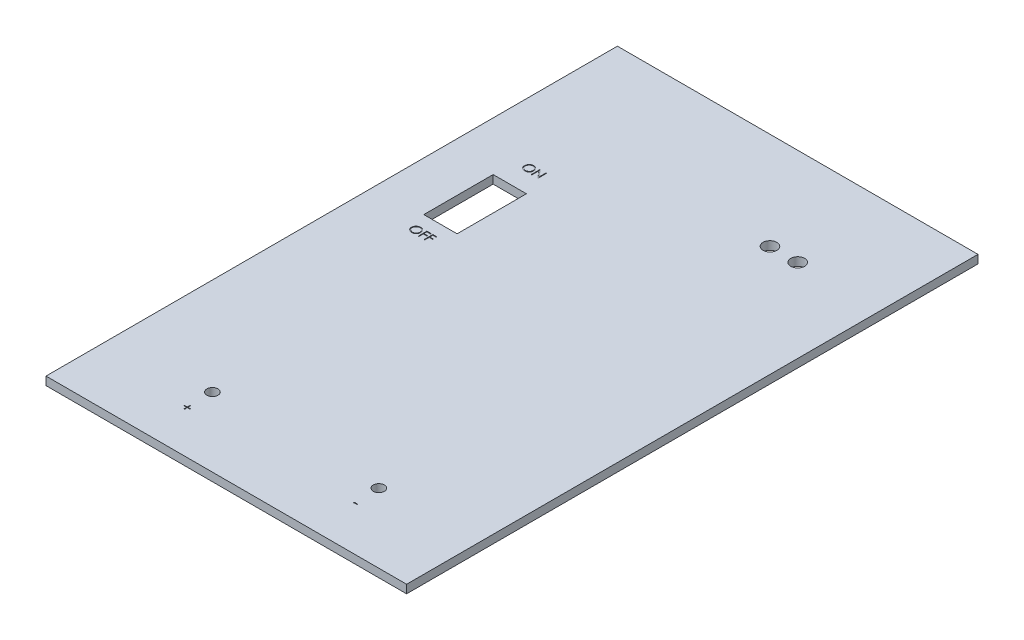
from build123d import *

# Parameters (mm, degrees)
SKETCH1_W           = 130
SKETCH1_H           = 206
BOSS_EXTRUDE1_DEPTH = 3
SKETCH2_R           = 2.5
CUT_EXTRUDE1_DEPTH  = 10
SKETCH4_R           = 2
SKETCH4_W           = 12
SKETCH4_H           = 25
CUT_EXTRUDE2_DEPTH  = 4
CUT_EXTRUDE3_DEPTH  = 0.2
CUT_EXTRUDE4_DEPTH  = 0.2
CUT_EXTRUDE5_DEPTH  = 0.2
SKETCH9_W           = 1.221153846
SKETCH9_H           = 0.325641026
CUT_EXTRUDE6_DEPTH  = 0.2


with BuildPart() as part:
    # Sketch1 → Boss-Extrude1 (new body)
    with BuildSketch(Plane(origin=(0, 0, 0), x_dir=(1, 0, 0), z_dir=(0, 1, 0))):
        Rectangle(SKETCH1_W, SKETCH1_H)
    extrude(amount=BOSS_EXTRUDE1_DEPTH)

    # Sketch2 → Cut-Extrude1 (cut)
    with BuildSketch(Plane(origin=(0, 3, 0), x_dir=(1, 0, 0), z_dir=(0, 1, 0))):
        with Locations(Location((35, 68, 0), (0, 0, 270))):
            Circle(SKETCH2_R)
        with Locations(Location((25, 68, 0), (0, 0, 270))):
            Circle(SKETCH2_R)
    extrude(amount=-CUT_EXTRUDE1_DEPTH, mode=Mode.SUBTRACT)

    # Sketch4 → Cut-Extrude2 (cut)
    with BuildSketch(Plane(origin=(0, 3, 0), x_dir=(1, 0, 0), z_dir=(0, 1, 0))):
        with Locations(Location((-30, -78, 0), (0, 0, 270))):
            Circle(SKETCH4_R)
        with Locations(Location((30, -78, 0), (0, 0, 270))):
            Circle(SKETCH4_R)
        with Locations((-41.313427864, 28.013893321)):
            Rectangle(SKETCH4_W, SKETCH4_H)
    extrude(amount=-CUT_EXTRUDE2_DEPTH, mode=Mode.SUBTRACT)

    # Sketch6 → Cut-Extrude3 (cut)
    # profile 1 of 3: a face of its own
    with BuildSketch(Plane(origin=(0, 3, 0), x_dir=(1, 0, 0), z_dir=(0, 1, 0))):
        with BuildLine():
            add(Edge.make_bspline(
                [(-43.926968434, 11.005869869), (-43.868178224, 11.004380812), (-43.7527094, 11.001456183), (-43.583005743, 10.97906871), (-43.420994478, 10.940337892), (-43.265355852, 10.888755044), (-43.117951509, 10.81994428), (-42.977671942, 10.736772753), (-42.844850921, 10.638369108), (-42.721278668, 10.525494024), (-42.608197005, 10.40268189), (-42.508569237, 10.271619786), (-42.425073728, 10.133100158), (-42.356506621, 9.987539262), (-42.302714311, 9.835266291), (-42.265594893, 9.675469446), (-42.241883856, 9.509184091), (-42.23911183, 9.395766864), (-42.237705613, 9.338231647)],
                knots=[0, 0, 0, 0, 1.065120563, 2.091984664, 3.0946048, 4.079830382, 5.057816894, 6.036188127, 7.030412546, 8.04752943, 9.064399622, 10.05169764, 11.02544977, 11.989514704, 12.962713494, 13.945757189, 14.957906945, 16, 16, 16, 16], degree=3))
            add(Edge.make_bspline(
                [(-42.237705613, 9.338231647), (-42.239111624, 9.28112025), (-42.241883033, 9.168547068), (-42.265621852, 9.003316944), (-42.302851902, 8.844484669), (-42.356007087, 8.692315399), (-42.424247342, 8.546648609), (-42.508298819, 8.407867586), (-42.607305488, 8.275926834), (-42.719978846, 8.152271773), (-42.842806934, 8.038881211), (-42.974551533, 7.940076231), (-43.112249759, 7.85505506), (-43.257673566, 7.787215585), (-43.408894314, 7.732993914), (-43.567265421, 7.696025457), (-43.732044795, 7.672179353), (-43.844413491, 7.669441128), (-43.901527729, 7.668049356)],
                knots=[0, 0, 0, 0, 1.043624062, 2.057103931, 3.04512605, 4.022047818, 4.998200453, 5.980619268, 6.982898556, 8.009068085, 9.034988726, 10.034168286, 11.015286542, 11.987931943, 12.962482838, 13.94673481, 14.956375938, 16, 16, 16, 16], degree=3))
            add(Edge.make_bspline(
                [(-43.901527729, 7.668049356), (-43.959062647, 7.669454871), (-44.072479285, 7.672225516), (-44.238973596, 7.69597579), (-44.398882692, 7.733115401), (-44.551749282, 7.786191818), (-44.697658611, 7.854787449), (-44.836896044, 7.938429993), (-44.968902699, 8.0376779), (-45.09258414, 8.150314721), (-45.205749484, 8.272934629), (-45.304409775, 8.404319989), (-45.388071128, 8.541893153), (-45.456436436, 8.686035907), (-45.510560625, 8.83605143), (-45.54748571, 8.992940406), (-45.57137618, 9.155808386), (-45.57412922, 9.266700158), (-45.575526126, 9.322967224)],
                knots=[0, 0, 0, 0, 1.053102029, 2.075944431, 3.073151272, 4.055350789, 5.033113405, 6.020478099, 7.024410459, 8.052272461, 9.079885166, 10.07527673, 11.055994387, 12.023226415, 12.992069828, 13.970394897, 14.97016774, 16, 16, 16, 16], degree=3))
            add(Edge.make_bspline(
                [(-45.575526126, 9.322967224), (-45.575041135, 9.360734003), (-45.574077272, 9.435791115), (-45.56247338, 9.547248674), (-45.545635265, 9.65691377), (-45.52150353, 9.764474559), (-45.489942518, 9.869667738), (-45.452702465, 9.973218787), (-45.407218462, 10.074078308), (-45.355801017, 10.172724099), (-45.29841352, 10.267618413), (-45.235026233, 10.357316321), (-45.167865577, 10.442570511), (-45.094238784, 10.521171722), (-45.016572438, 10.595406538), (-44.933606623, 10.664134146), (-44.845847587, 10.72797428), (-44.752917714, 10.785505589), (-44.65710685, 10.837538519), (-44.558340059, 10.882189769), (-44.457958741, 10.920512982), (-44.355492739, 10.951574302), (-44.251214153, 10.976096221), (-44.144895391, 10.99279432), (-44.036621154, 11.004427808), (-43.9636766, 11.005387114), (-43.926968434, 11.005869869)],
                knots=[0, 0, 0, 0, 1.037015668, 2.060948919, 3.074880161, 4.083647147, 5.086022904, 6.090072063, 7.104153813, 8.122640571, 9.144368836, 10.147691507, 11.138137339, 12.123020368, 13.103399296, 14.087645067, 15.080126199, 16.082011238, 17.087798457, 18.072939717, 19.057185487, 20.037253025, 21.01195951, 21.997135196, 22.992090687, 24, 24, 24, 24], degree=3))
        make_face()
        with BuildLine():
            add(Edge.make_bspline(
                [(-43.912976046, 10.680228843), (-43.943106464, 10.67986155), (-44.00307925, 10.679130474), (-44.092237365, 10.669500504), (-44.180222905, 10.655775533), (-44.267054041, 10.636198011), (-44.35236746, 10.609524334), (-44.436958388, 10.578825796), (-44.520055444, 10.541432378), (-44.6013843, 10.499184282), (-44.68022869, 10.452422047), (-44.754625926, 10.400740515), (-44.824768611, 10.345351684), (-44.890485002, 10.286126289), (-44.951582137, 10.222762721), (-45.009262545, 10.156221583), (-45.061214237, 10.084600939), (-45.108826153, 10.009842927), (-45.151432694, 9.932044921), (-45.189319837, 9.852025975), (-45.220311474, 9.769133359), (-45.245586629, 9.684266373), (-45.266541458, 9.597559427), (-45.279816517, 9.508354764), (-45.289552301, 9.417100627), (-45.290241589, 9.355431374), (-45.290590229, 9.32423926)],
                knots=[0, 0, 0, 0, 1.008559885, 2.007477868, 2.99961109, 3.989939068, 4.984837346, 5.991145699, 7.001802488, 8.033829008, 9.059044045, 10.069351652, 11.065060232, 12.050310815, 13.029377138, 14.011219647, 14.996725999, 15.989392538, 16.977580475, 17.965360261, 18.951710183, 19.937753436, 20.929683414, 21.935841486, 22.955955122, 24, 24, 24, 24], degree=3))
            add(Edge.make_bspline(
                [(-45.290590229, 9.32423926), (-45.289433747, 9.278372102), (-45.287158589, 9.188137214), (-45.267239936, 9.055904684), (-45.236558574, 8.928824595), (-45.19133082, 8.807592292), (-45.134769905, 8.691165692), (-45.064895512, 8.580577626), (-44.982110484, 8.475798204), (-44.888072857, 8.377558924), (-44.785272973, 8.287891659), (-44.676113996, 8.209184853), (-44.561765367, 8.142591269), (-44.44192889, 8.088339525), (-44.317244337, 8.045350263), (-44.186908272, 8.015887504), (-44.051788927, 7.996496913), (-43.959686118, 7.99463477), (-43.912976046, 7.993690381)],
                knots=[0, 0, 0, 0, 1.032063989, 2.030389145, 3.003944642, 3.970395727, 4.937377036, 5.913328081, 6.909231446, 7.93887556, 8.970685674, 9.976071282, 10.964166581, 11.944589148, 12.933237628, 13.927779006, 14.949070134, 16, 16, 16, 16], degree=3))
            add(Edge.make_bspline(
                [(-43.912976046, 7.993690381), (-43.881580284, 7.994121732), (-43.819313058, 7.994977229), (-43.726697834, 8.003593886), (-43.635751128, 8.017411368), (-43.546600503, 8.037305605), (-43.459347138, 8.062204142), (-43.373626852, 8.09178401), (-43.290352689, 8.128687673), (-43.208474122, 8.169461887), (-43.130100388, 8.215944029), (-43.055283298, 8.265871494), (-42.985908659, 8.321178743), (-42.92024143, 8.379524187), (-42.858893455, 8.442084249), (-42.802279591, 8.508777593), (-42.750590471, 8.580025189), (-42.702996635, 8.654669807), (-42.660539389, 8.732680694), (-42.623546921, 8.812989759), (-42.592163301, 8.895399251), (-42.566828158, 8.980028033), (-42.546974917, 9.066715375), (-42.533295276, 9.155577346), (-42.523726335, 9.246436178), (-42.523005086, 9.307889533), (-42.522641511, 9.338867665)],
                knots=[0, 0, 0, 0, 1.047197238, 2.076906641, 3.100256066, 4.114471768, 5.12198147, 6.126382909, 7.136867548, 8.15857795, 9.17633901, 10.174870724, 11.156907918, 12.133735059, 13.104061851, 14.077631395, 15.04955518, 16.038496417, 17.029181396, 18.010275684, 18.986308667, 19.968651475, 20.955262928, 21.950658345, 22.966943676, 24, 24, 24, 24], degree=3))
            add(Edge.make_bspline(
                [(-42.522641511, 9.338867665), (-42.523005378, 9.369633873), (-42.523727174, 9.430664312), (-42.533290705, 9.520889483), (-42.54698937, 9.609112039), (-42.566731255, 9.694985632), (-42.592176752, 9.778532151), (-42.623552401, 9.85967313), (-42.660550494, 9.938710849), (-42.703012241, 10.015449962), (-42.750742309, 10.089087045), (-42.802897801, 10.15948352), (-42.860379224, 10.225317364), (-42.921544261, 10.288213836), (-42.987920707, 10.346831493), (-43.059207888, 10.40118978), (-43.134540367, 10.452600536), (-43.214302931, 10.498978724), (-43.29662066, 10.541808778), (-43.381088322, 10.578503616), (-43.466749005, 10.609684039), (-43.553384879, 10.636278714), (-43.641725152, 10.655698856), (-43.731172911, 10.669512873), (-43.821604403, 10.679127123), (-43.882422181, 10.679860438), (-43.912976046, 10.680228843)],
                knots=[0, 0, 0, 0, 1.02996197, 2.043119294, 3.035359645, 4.018872909, 4.991431989, 5.957985074, 6.929999688, 7.912076566, 8.892894881, 9.867085534, 10.843653904, 11.817741046, 12.803660682, 13.806313499, 14.818574707, 15.856120519, 16.894564902, 17.924820532, 18.937903209, 19.946497019, 20.957711757, 21.963978472, 22.977135795, 24, 24, 24, 24], degree=3))
        make_face(mode=Mode.SUBTRACT)
    # profile 2 of 3: a face of its own
    with BuildSketch(Plane(origin=(0, 3, 0), x_dir=(1, 0, 0), z_dir=(0, 1, 0))):
        Polygon((-41.586423562, 10.924459612), (-40.03962869, 10.924459612), (-40.03962869, 10.598818587), (-41.301487665, 10.598818587), (-41.301487665, 9.62189551), (-40.03962869, 9.62189551), (-40.03962869, 9.296254484), (-41.301487665, 9.296254484), (-41.301487665, 7.749459612), (-41.586423562, 7.749459612), align=None)
    # profile 3 of 3: a face of its own
    with BuildSketch(Plane(origin=(0, 3, 0), x_dir=(1, 0, 0), z_dir=(0, 1, 0))):
        Polygon((-39.469756895, 10.924459612), (-37.922962024, 10.924459612), (-37.922962024, 10.598818587), (-39.184820998, 10.598818587), (-39.184820998, 9.62189551), (-37.922962024, 9.62189551), (-37.922962024, 9.296254484), (-39.184820998, 9.296254484), (-39.184820998, 7.749459612), (-39.469756895, 7.749459612), align=None)
    extrude(amount=-CUT_EXTRUDE3_DEPTH, mode=Mode.SUBTRACT)

    # Sketch7 → Cut-Extrude4 (cut)
    # profile 1 of 2: a face of its own
    with BuildSketch(Plane(origin=(0, 3, 0), x_dir=(1, 0, 0), z_dir=(0, 1, 0))):
        with BuildLine():
            add(Edge.make_bspline(
                [(-42.796304845, 50.634513267), (-42.737514635, 50.633024211), (-42.622045811, 50.630099581), (-42.452342154, 50.607712109), (-42.290330889, 50.568981291), (-42.134692263, 50.517398442), (-41.98728792, 50.448587678), (-41.847008353, 50.365416151), (-41.714187332, 50.267012506), (-41.590615079, 50.154137422), (-41.477533417, 50.031325289), (-41.377905648, 49.900263185), (-41.294410139, 49.761743557), (-41.225843032, 49.61618266), (-41.172050722, 49.463909689), (-41.134931304, 49.304112844), (-41.111220267, 49.137827489), (-41.108448241, 49.024410262), (-41.107042024, 48.966875046)],
                knots=[0, 0, 0, 0, 1.065120563, 2.091984664, 3.0946048, 4.079830382, 5.057816894, 6.036188127, 7.030412546, 8.04752943, 9.064399622, 10.05169764, 11.02544977, 11.989514704, 12.962713494, 13.945757189, 14.957906945, 16, 16, 16, 16], degree=3))
            add(Edge.make_bspline(
                [(-41.107042024, 48.966875046), (-41.108448035, 48.909763648), (-41.111219444, 48.797190467), (-41.134958263, 48.631960342), (-41.172188313, 48.473128068), (-41.225343498, 48.320958797), (-41.293583753, 48.175292007), (-41.37763523, 48.036510984), (-41.4766419, 47.904570232), (-41.589315257, 47.780915172), (-41.712143345, 47.667524609), (-41.843887945, 47.568719629), (-41.98158617, 47.483698459), (-42.127009977, 47.415858983), (-42.278230725, 47.361637312), (-42.436601832, 47.324668855), (-42.601381206, 47.300822752), (-42.713749903, 47.298084526), (-42.77086414, 47.296692754)],
                knots=[0, 0, 0, 0, 1.043624062, 2.057103931, 3.04512605, 4.022047818, 4.998200453, 5.980619268, 6.982898556, 8.009068085, 9.034988726, 10.034168286, 11.015286542, 11.987931943, 12.962482838, 13.94673481, 14.956375938, 16, 16, 16, 16], degree=3))
            add(Edge.make_bspline(
                [(-42.77086414, 47.296692754), (-42.828399058, 47.298098269), (-42.941815697, 47.300868914), (-43.108310007, 47.324619188), (-43.268219103, 47.3617588), (-43.421085693, 47.414835217), (-43.566995022, 47.483430847), (-43.706232455, 47.567073391), (-43.83823911, 47.666321298), (-43.961920551, 47.778958119), (-44.075085895, 47.901578027), (-44.173746186, 48.032963387), (-44.257407539, 48.170536551), (-44.325772847, 48.314679305), (-44.379897036, 48.464694828), (-44.416822121, 48.621583804), (-44.440712591, 48.784451785), (-44.443465631, 48.895343557), (-44.444862537, 48.951610623)],
                knots=[0, 0, 0, 0, 1.053102029, 2.075944431, 3.073151272, 4.055350789, 5.033113405, 6.020478099, 7.024410459, 8.052272461, 9.079885166, 10.07527673, 11.055994387, 12.023226415, 12.992069828, 13.970394897, 14.97016774, 16, 16, 16, 16], degree=3))
            add(Edge.make_bspline(
                [(-44.444862537, 48.951610623), (-44.444377547, 48.989377401), (-44.443413683, 49.064434513), (-44.431809791, 49.175892072), (-44.414971676, 49.285557168), (-44.390839941, 49.393117957), (-44.359278929, 49.498311136), (-44.322038876, 49.601862185), (-44.276554873, 49.702721706), (-44.225137428, 49.801367497), (-44.167749931, 49.896261812), (-44.104362644, 49.985959719), (-44.037201988, 50.071213909), (-43.963575195, 50.14981512), (-43.885908849, 50.224049937), (-43.802943034, 50.292777544), (-43.715183998, 50.356617678), (-43.622254125, 50.414148988), (-43.526443261, 50.466181917), (-43.42767647, 50.510833167), (-43.327295152, 50.54915638), (-43.22482915, 50.5802177), (-43.120550564, 50.604739619), (-43.014231802, 50.621437718), (-42.905957565, 50.633071207), (-42.833013012, 50.634030512), (-42.796304845, 50.634513267)],
                knots=[0, 0, 0, 0, 1.037015668, 2.060948919, 3.074880161, 4.083647147, 5.086022904, 6.090072063, 7.104153813, 8.122640571, 9.144368836, 10.147691507, 11.138137339, 12.123020368, 13.103399296, 14.087645067, 15.080126199, 16.082011238, 17.087798457, 18.072939717, 19.057185487, 20.037253025, 21.01195951, 21.997135196, 22.992090687, 24, 24, 24, 24], degree=3))
        make_face()
        with BuildLine():
            add(Edge.make_bspline(
                [(-42.782312457, 50.308872241), (-42.812442875, 50.308504948), (-42.872415661, 50.307773873), (-42.961573776, 50.298143902), (-43.049559316, 50.284418931), (-43.136390452, 50.264841409), (-43.221703871, 50.238167733), (-43.306294799, 50.207469194), (-43.389391855, 50.170075777), (-43.470720712, 50.12782768), (-43.549565101, 50.081065445), (-43.623962337, 50.029383914), (-43.694105022, 49.973995082), (-43.759821413, 49.914769687), (-43.820918548, 49.85140612), (-43.878598956, 49.784864981), (-43.930550648, 49.713244337), (-43.978162564, 49.638486325), (-44.020769105, 49.560688319), (-44.058656248, 49.480669373), (-44.089647885, 49.397776757), (-44.11492304, 49.312909771), (-44.135877869, 49.226202826), (-44.149152928, 49.136998163), (-44.158888712, 49.045744025), (-44.159578, 48.984074772), (-44.15992664, 48.952882658)],
                knots=[0, 0, 0, 0, 1.008559885, 2.007477868, 2.99961109, 3.989939068, 4.984837346, 5.991145699, 7.001802488, 8.033829008, 9.059044045, 10.069351652, 11.065060232, 12.050310815, 13.029377138, 14.011219647, 14.996725999, 15.989392538, 16.977580475, 17.965360261, 18.951710183, 19.937753436, 20.929683414, 21.935841486, 22.955955122, 24, 24, 24, 24], degree=3))
            add(Edge.make_bspline(
                [(-44.15992664, 48.952882658), (-44.158770158, 48.9070155), (-44.156495, 48.816780612), (-44.136576347, 48.684548082), (-44.105894985, 48.557467993), (-44.060667231, 48.43623569), (-44.004106316, 48.319809091), (-43.934231923, 48.209221024), (-43.851446895, 48.104441602), (-43.757409268, 48.006202323), (-43.654609384, 47.916535057), (-43.545450407, 47.837828251), (-43.431101778, 47.771234667), (-43.311265301, 47.716982923), (-43.186580748, 47.673993661), (-43.056244684, 47.644530903), (-42.921125338, 47.625140311), (-42.829022529, 47.623278168), (-42.782312457, 47.62233378)],
                knots=[0, 0, 0, 0, 1.032063989, 2.030389145, 3.003944642, 3.970395727, 4.937377036, 5.913328081, 6.909231446, 7.93887556, 8.970685674, 9.976071282, 10.964166581, 11.944589148, 12.933237628, 13.927779006, 14.949070134, 16, 16, 16, 16], degree=3))
            add(Edge.make_bspline(
                [(-42.782312457, 47.62233378), (-42.750916695, 47.62276513), (-42.688649469, 47.623620627), (-42.596034245, 47.632237284), (-42.505087539, 47.646054766), (-42.415936914, 47.665949003), (-42.328683549, 47.690847541), (-42.242963263, 47.720427408), (-42.1596891, 47.757331072), (-42.077810533, 47.798105285), (-41.999436799, 47.844587428), (-41.924619709, 47.894514892), (-41.85524507, 47.949822141), (-41.789577841, 48.008167585), (-41.728229866, 48.070727647), (-41.671616002, 48.137420991), (-41.619926882, 48.208668587), (-41.572333046, 48.283313205), (-41.5298758, 48.361324092), (-41.492883332, 48.441633157), (-41.461499712, 48.524042649), (-41.436164569, 48.608671431), (-41.416311328, 48.695358773), (-41.402631687, 48.784220744), (-41.393062746, 48.875079576), (-41.392341497, 48.936532931), (-41.391977922, 48.967511063)],
                knots=[0, 0, 0, 0, 1.047197238, 2.076906641, 3.100256066, 4.114471768, 5.12198147, 6.126382909, 7.136867548, 8.15857795, 9.17633901, 10.174870724, 11.156907918, 12.133735059, 13.104061851, 14.077631395, 15.04955518, 16.038496417, 17.029181396, 18.010275684, 18.986308667, 19.968651475, 20.955262928, 21.950658345, 22.966943676, 24, 24, 24, 24], degree=3))
            add(Edge.make_bspline(
                [(-41.391977922, 48.967511063), (-41.392341789, 48.998277271), (-41.393063585, 49.059307711), (-41.402627116, 49.149532882), (-41.416325781, 49.237755438), (-41.436067666, 49.32362903), (-41.461513163, 49.40717555), (-41.492888812, 49.488316528), (-41.529886905, 49.567354248), (-41.572348652, 49.64409336), (-41.62007872, 49.717730444), (-41.672234212, 49.788126918), (-41.729715635, 49.853960762), (-41.790880672, 49.916857234), (-41.857257118, 49.975474891), (-41.928544299, 50.029833178), (-42.003876778, 50.081243934), (-42.083639342, 50.127622122), (-42.165957071, 50.170452176), (-42.250424733, 50.207147015), (-42.336085416, 50.238327437), (-42.42272129, 50.264922113), (-42.511061563, 50.284342254), (-42.600509322, 50.298156271), (-42.690940814, 50.307770521), (-42.751758592, 50.308503836), (-42.782312457, 50.308872241)],
                knots=[0, 0, 0, 0, 1.02996197, 2.043119294, 3.035359645, 4.018872909, 4.991431989, 5.957985074, 6.929999688, 7.912076566, 8.892894881, 9.867085534, 10.843653904, 11.817741046, 12.803660682, 13.806313499, 14.818574707, 15.856120519, 16.894564902, 17.924820532, 18.937903209, 19.946497019, 20.957711757, 21.963978472, 22.977135795, 24, 24, 24, 24], degree=3))
        make_face(mode=Mode.SUBTRACT)
    # profile 2 of 2: a face of its own
    with BuildSketch(Plane(origin=(0, 3, 0), x_dir=(1, 0, 0), z_dir=(0, 1, 0))):
        Polygon((-40.455759973, 47.37810301), (-40.455759973, 50.55310301), (-40.395974316, 50.55310301), (-38.298388178, 48.054189749), (-38.298388178, 50.55310301), (-38.013452281, 50.55310301), (-38.013452281, 47.37810301), (-38.078326079, 47.37810301), (-40.170824076, 49.871292113), (-40.170824076, 47.37810301), align=None)
    extrude(amount=-CUT_EXTRUDE4_DEPTH, mode=Mode.SUBTRACT)

    # Sketch8 → Cut-Extrude5 (cut)
    with BuildSketch(Plane(origin=(0, 3, 0), x_dir=(1, 0, 0), z_dir=(0, 1, 0))):
        Polygon((-29.879159623, -87.179696401), (-29.879159623, -86.243478453), (-29.594223725, -86.243478453), (-29.594223725, -87.179696401), (-28.658005777, -87.179696401), (-28.658005777, -87.464632299), (-29.594223725, -87.464632299), (-29.594223725, -88.400850248), (-29.879159623, -88.400850248), (-29.879159623, -87.464632299), (-30.815377571, -87.464632299), (-30.815377571, -87.179696401), align=None)
    extrude(amount=-CUT_EXTRUDE5_DEPTH, mode=Mode.SUBTRACT)

    # Sketch9 → Cut-Extrude6 (cut)
    with BuildSketch(Plane(origin=(0, 3, 0), x_dir=(1, 0, 0), z_dir=(0, 1, 0))):
        with Locations((30.589232312, -86.952521743)):
            Rectangle(SKETCH9_W, SKETCH9_H)
    extrude(amount=-CUT_EXTRUDE6_DEPTH, mode=Mode.SUBTRACT)


solid = part.part
